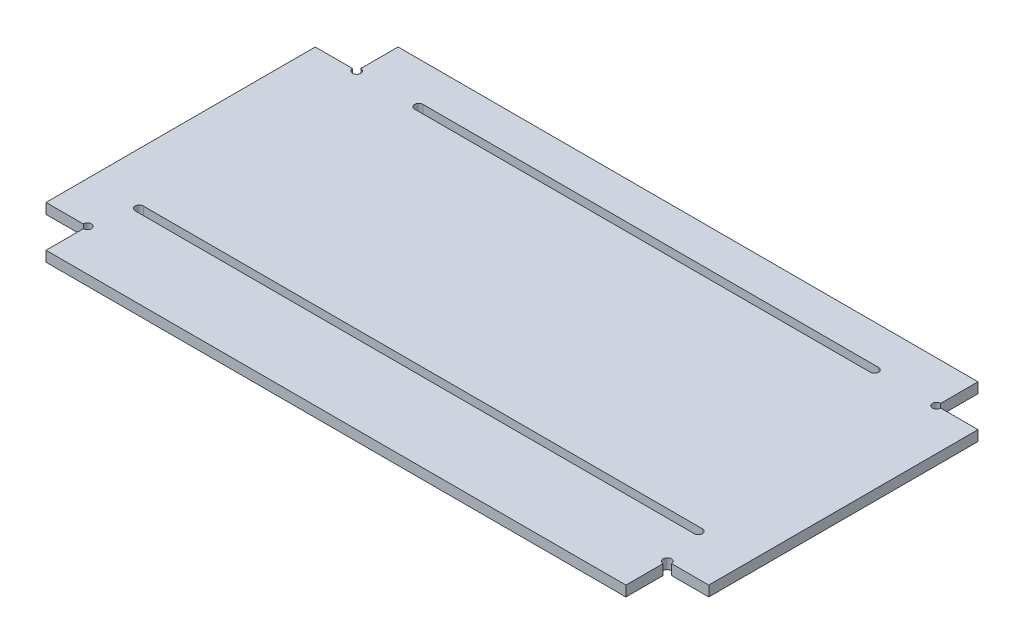
from build123d import *

# Parameters (mm, degrees)
SKIZZE1_W                       = 320
SKIZZE1_H                       = 170
AUFSATZ_LINEAR_AUSTRAGEN1_DEPTH = 5
SKIZZE2_W                       = 20
SKIZZE2_H                       = 20
SCHNITT_LINEAR_AUSTRAGEN1_DEPTH = 182.245689604
SCHNITT_LINEAR_AUSTRAGEN2_DEPTH = 182.245689604
SKIZZE4_R                       = 2
SCHNITT_LINEAR_AUSTRAGEN3_DEPTH = 182.245689604


with BuildPart() as part:
    # Skizze1 → Aufsatz-Linear austragen1 (new body)
    with BuildSketch(Plane(origin=(0, 0, 0), x_dir=(1, 0, 0), z_dir=(0, 1, 0))):
        Rectangle(SKIZZE1_W, SKIZZE1_H)
    extrude(amount=AUFSATZ_LINEAR_AUSTRAGEN1_DEPTH)

    # Skizze2 → Schnitt-Linear austragen1 (cut, through all)
    with BuildSketch(Plane(origin=(0, 5, 0), x_dir=(1, 0, 0), z_dir=(0, 1, 0))):
        with Locations((-150, 75)):
            Rectangle(SKIZZE2_W, SKIZZE2_H)
        with Locations((150, 75)):
            Rectangle(SKIZZE2_W, SKIZZE2_H)
        with Locations((150, -75)):
            Rectangle(SKIZZE2_W, SKIZZE2_H)
        with Locations((-150, -75)):
            Rectangle(SKIZZE2_W, SKIZZE2_H)
    extrude(amount=-SCHNITT_LINEAR_AUSTRAGEN1_DEPTH, mode=Mode.SUBTRACT)

    # Skizze3 → Schnitt-Linear austragen2 (cut, through all)
    with BuildSketch(Plane(origin=(0, 5, 0), x_dir=(1, 0, 0), z_dir=(0, 1, 0))):
        with BuildLine():
            Line((-110, 67), (110, 67))
            ThreePointArc((110, 67), (112, 65), (110, 63))
            Line((110, 63), (-110, 63))
            ThreePointArc((-110, 63), (-112, 65), (-110, 67))
        make_face()
        with BuildLine():
            Line((-135, -43), (135, -43))
            ThreePointArc((135, -43), (137, -45), (135, -47))
            Line((135, -47), (-135, -47))
            ThreePointArc((-135, -47), (-137, -45), (-135, -43))
        make_face()
    extrude(amount=-SCHNITT_LINEAR_AUSTRAGEN2_DEPTH, mode=Mode.SUBTRACT)

    # Skizze4 → Schnitt-Linear austragen3 (cut, through all)
    with BuildSketch(Plane(origin=(0, 5, 0), x_dir=(1, 0, 0), z_dir=(0, 1, 0))):
        with Locations((-140, 65)):
            Circle(SKIZZE4_R)
        with Locations((-140, -65)):
            Circle(SKIZZE4_R)
        with Locations((140, -65)):
            Circle(SKIZZE4_R)
        with Locations((140, 65)):
            Circle(SKIZZE4_R)
    extrude(amount=-SCHNITT_LINEAR_AUSTRAGEN3_DEPTH, mode=Mode.SUBTRACT)


solid = part.part
